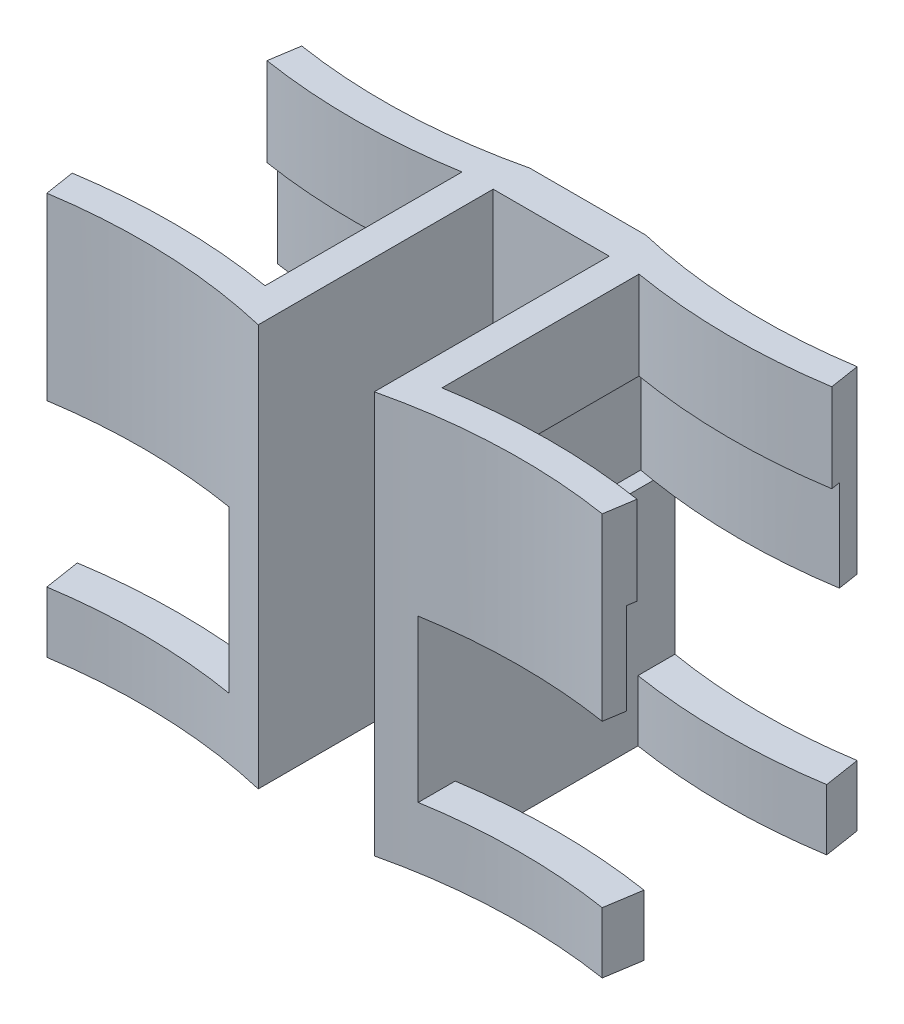
from build123d import *

# Parameters (mm, degrees)
BOSS_EXTRUDE1_DEPTH = 66
CUT_EXTRUDE1_START  = -15
CUT_EXTRUDE1_DEPTH  = 15
CUT_EXTRUDE2_START  = -14.5
CUT_EXTRUDE2_DEPTH  = 15
SKETCH4_W           = 44.566501288
SKETCH4_H           = 26.5
CUT_EXTRUDE3_DEPTH  = 99.455967425
SKETCH5_W           = 44.566501288
SKETCH5_H           = 26.5
CUT_EXTRUDE4_DEPTH  = 99.455967425


with BuildPart() as part:
    # Sketch1 → Boss-Extrude1 (new body)
    with BuildSketch(Plane(origin=(0, 0, 0), x_dir=(1, 0, 0), z_dir=(0, 1, 0))):
        with BuildLine():
            Line((-6, -1.283250644), (-6, -31.283250644))
            ThreePointArc((-6, -31.283250644), (-21.5, -30.074697642), (-37, -31.283250644))
            Line((-37, -31.283250644), (-36.07, -37.210737464))
            ThreePointArc((-36.07, -37.210737464), (-17.969313256, -36.14102822), (0, -38.566501288))
            Line((0, -38.566501288), (0, 0))
            Line((0, 0), (19.05, 0))
            Line((19.05, 0), (19.05, -38.566501288))
            ThreePointArc((19.05, -38.566501288), (37.019313256, -36.14102822), (55.12, -37.210737464))
            Line((55.12, -37.210737464), (56.05, -31.283250644))
            ThreePointArc((56.05, -31.283250644), (40.55, -30.074697642), (25.05, -31.283250644))
            Line((25.05, -31.283250644), (25.05, -1.283250644))
            ThreePointArc((25.05, -1.283250644), (40.55, -2.491803646), (56.05, -1.283250644))
            Line((56.05, -1.283250644), (55.12, 4.644236176))
            ThreePointArc((55.12, 4.644236176), (37.019313256, 3.574526932), (19.05, 6))
            Line((19.05, 6), (0, 6))
            ThreePointArc((0, 6), (-17.969313256, 3.574526932), (-36.07, 4.644236176))
            Line((-36.07, 4.644236176), (-37, -1.283250644))
            ThreePointArc((-37, -1.283250644), (-21.5, -2.491803646), (-6, -1.283250644))
        make_face()
    extrude(amount=BOSS_EXTRUDE1_DEPTH)

    # Sketch2 → Cut-Extrude1 (cut)
    # profile 1 of 2: a face of its own
    with BuildSketch(Plane(origin=(0, 66, 0), x_dir=(1, 0, 0), z_dir=(0, 1, 0)).offset(CUT_EXTRUDE1_START)):
        with BuildLine():
            Line((-5, -0.107120067), (-5, -32.459381221))
            ThreePointArc((-5, -32.459381221), (-21.5, -31.074697642), (-38, -32.459381221))
            Line((-38, -32.459381221), (-38, -0.107120067))
            ThreePointArc((-38, -0.107120067), (-21.5, -1.491803646), (-5, -0.107120067))
        make_face()
        with BuildLine():
            Line((-6, -1.283250644), (-6, -31.283250644))
            ThreePointArc((-6, -31.283250644), (-21.5, -30.074697642), (-37, -31.283250644))
            Line((-37, -31.283250644), (-37, -1.283250644))
            ThreePointArc((-37, -1.283250644), (-21.5, -2.491803646), (-6, -1.283250644))
        make_face(mode=Mode.SUBTRACT)
    # profile 2 of 2: a face of its own
    with BuildSketch(Plane(origin=(0, 66, 0), x_dir=(1, 0, 0), z_dir=(0, 1, 0)).offset(CUT_EXTRUDE1_START)):
        with BuildLine():
            Line((57.05, -0.107120067), (57.05, -32.459381221))
            ThreePointArc((57.05, -32.459381221), (40.55, -31.074697642), (24.05, -32.459381221))
            Line((24.05, -32.459381221), (24.05, -0.107120067))
            ThreePointArc((24.05, -0.107120067), (40.55, -1.491803646), (57.05, -0.107120067))
        make_face()
        with BuildLine():
            Line((25.05, -1.283250644), (25.05, -31.283250644))
            ThreePointArc((25.05, -31.283250644), (40.55, -30.074697642), (56.05, -31.283250644))
            Line((56.05, -31.283250644), (56.05, -1.283250644))
            ThreePointArc((56.05, -1.283250644), (40.55, -2.491803646), (25.05, -1.283250644))
        make_face(mode=Mode.SUBTRACT)
    extrude(amount=CUT_EXTRUDE1_DEPTH, mode=Mode.SUBTRACT)

    # Sketch3 → Cut-Extrude2 (cut)
    # profile 1 of 2: a face of its own
    with BuildSketch(Plane(origin=(0, 51, 0), x_dir=(1, 0, 0), z_dir=(0, 1, 0)).offset(CUT_EXTRUDE2_START)):
        with BuildLine():
            Line((-3.5, 1.684138832), (-3.5, -34.25064012))
            ThreePointArc((-3.5, -34.25064012), (-21.5, -32.574697642), (-39.5, -34.25064012))
            Line((-39.5, -34.25064012), (-39.5, 1.684138832))
            ThreePointArc((-39.5, 1.684138832), (-21.5, 0.008196354), (-3.5, 1.684138832))
        make_face()
        with BuildLine():
            Line((-37, -1.283250644), (-37, -31.283250644))
            ThreePointArc((-37, -31.283250644), (-21.5, -30.074697642), (-6, -31.283250644))
            Line((-6, -31.283250644), (-6, -1.283250644))
            ThreePointArc((-6, -1.283250644), (-21.5, -2.491803646), (-37, -1.283250644))
        make_face(mode=Mode.SUBTRACT)
    # profile 2 of 2: a face of its own
    with BuildSketch(Plane(origin=(0, 51, 0), x_dir=(1, 0, 0), z_dir=(0, 1, 0)).offset(CUT_EXTRUDE2_START)):
        with BuildLine():
            Line((58.55, 1.684138832), (58.55, -34.25064012))
            ThreePointArc((58.55, -34.25064012), (40.55, -32.574697642), (22.55, -34.25064012))
            Line((22.55, -34.25064012), (22.55, 1.684138832))
            ThreePointArc((22.55, 1.684138832), (40.55, 0.008196354), (58.55, 1.684138832))
        make_face()
        with BuildLine():
            Line((25.05, -1.283250644), (25.05, -31.283250644))
            ThreePointArc((25.05, -31.283250644), (40.55, -30.074697642), (56.05, -31.283250644))
            Line((56.05, -31.283250644), (56.05, -1.283250644))
            ThreePointArc((56.05, -1.283250644), (40.55, -2.491803646), (25.05, -1.283250644))
        make_face(mode=Mode.SUBTRACT)
    extrude(amount=CUT_EXTRUDE2_DEPTH, mode=Mode.SUBTRACT)

    # Sketch4 → Cut-Extrude3 (cut, through all)
    with BuildSketch(Plane.ZY.offset(6)):
        with Locations((16.283250644, 23.25)):
            Rectangle(SKETCH4_W, SKETCH4_H)
    extrude(amount=CUT_EXTRUDE3_DEPTH, mode=Mode.SUBTRACT)

    # Sketch5 → Cut-Extrude4 (cut, through all)
    with BuildSketch(Plane(origin=(25.05, 0, 0), x_dir=(0, 0, -1), z_dir=(1, 0, 0))):
        with Locations((-16.283250644, 23.25)):
            Rectangle(SKETCH5_W, SKETCH5_H)
    extrude(amount=CUT_EXTRUDE4_DEPTH, mode=Mode.SUBTRACT)


solid = part.part
